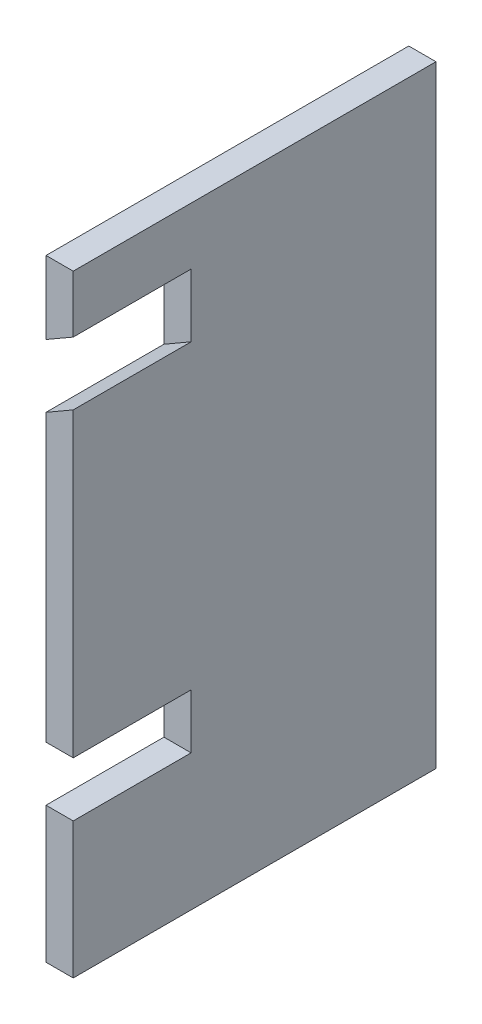
from build123d import *

# Parameters (mm, degrees)
SKETCH1_W           = 6
SKETCH1_H           = 135
BOSS_EXTRUDE1_DEPTH = 80
SKETCH2_W           = 6
SKETCH2_H           = 12.04
CUT_EXTRUDE1_DEPTH  = 26


with BuildPart() as part:
    # Sketch1 → Boss-Extrude1 (new body)
    with BuildSketch(Plane.XY):
        Rectangle(SKETCH1_W, SKETCH1_H)
    extrude(amount=BOSS_EXTRUDE1_DEPTH)

    # Sketch2 → Cut-Extrude1 (cut)
    with BuildSketch(Plane.XY.offset(80)):
        with Locations((0, -31.48)):
            Rectangle(SKETCH2_W, SKETCH2_H)
        Polygon((-3, 37.54), (3, 41.004101615), (3, 54.906696097), (-3, 51.442594482), align=None)
    extrude(amount=-CUT_EXTRUDE1_DEPTH, mode=Mode.SUBTRACT)


solid = part.part
